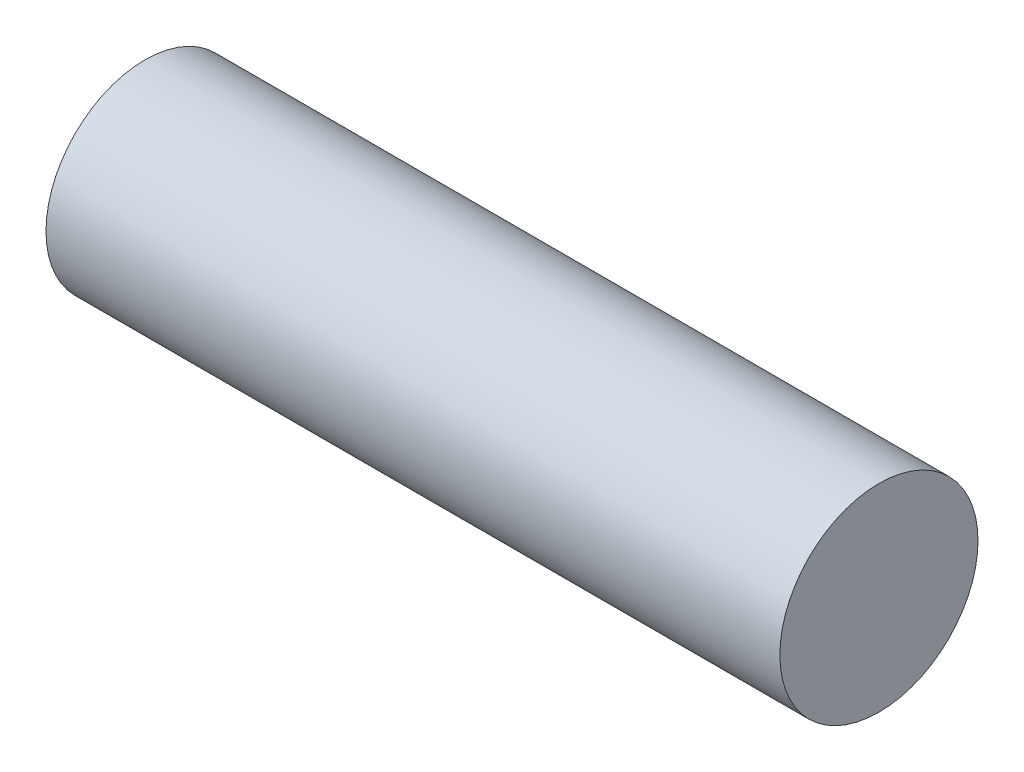
from build123d import *

# Parameters (mm, degrees)
SKETCH1_R           = 6
BOSS_EXTRUDE1_DEPTH = 44.45


with BuildPart() as part:
    # Sketch1 → Boss-Extrude1 (new body)
    with BuildSketch(Plane(origin=(0, 0, 0), x_dir=(0, 0, -1), z_dir=(1, 0, 0))):
        Circle(SKETCH1_R)
    extrude(amount=BOSS_EXTRUDE1_DEPTH)


solid = part.part
